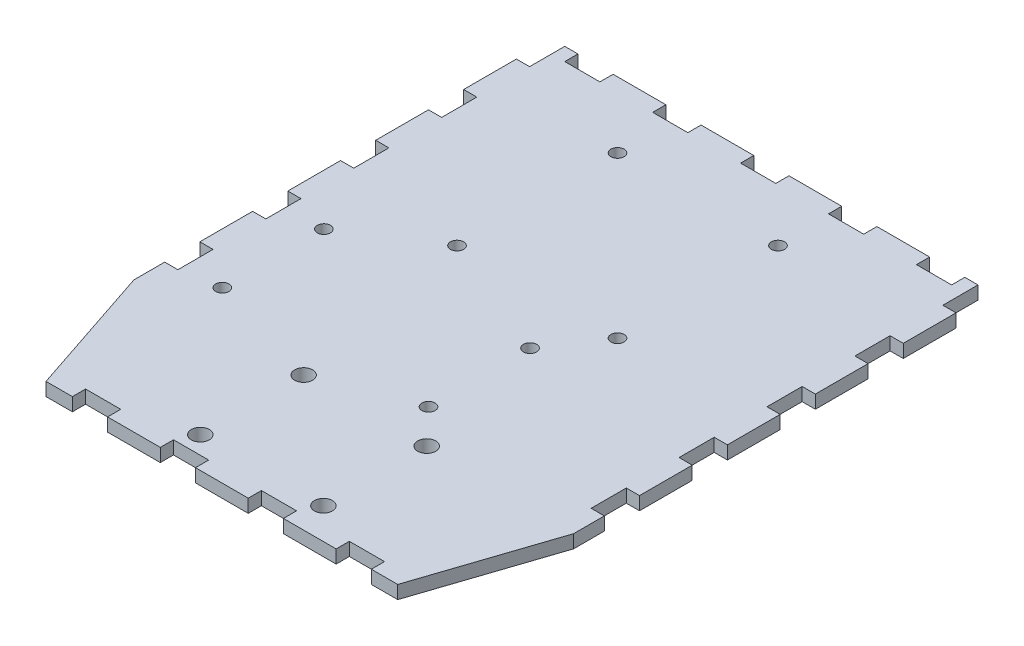
from build123d import *

# Parameters (mm, degrees)
ESQUISSE1_R        = 2.05
ESQUISSE1_R_2      = 1.5
BOSS_EXTRU_1_DEPTH = 3


with BuildPart() as part:
    # Esquisse1 → Boss.-Extru.1 (new body)
    with BuildSketch(Plane(origin=(0, 0, 0), x_dir=(1, 0, 0), z_dir=(0, 1, 0))):
        Polygon((44, -30), (56, -30), (56, -27), (64, -27), (64, -30), (76, -30), (76, -27), (84, -27), (84, -30), (90, -30), (100, 0), (100, 7), (97, 7), (97, 15), (100, 15), (100, 27), (97, 27), (97, 35), (100, 35), (100, 47), (97, 47), (97, 55), (100, 55), (100, 67), (97, 67), (97, 75), (100, 75), (100, 87), (97, 87), (97, 95), (94, 95), (94, 92), (86, 92), (86, 95), (74, 95), (74, 92), (66, 92), (66, 95), (54, 95), (54, 92), (46, 92), (46, 95), (34, 95), (34, 92), (26, 92), (26, 95), (14, 95), (14, 92), (6, 92), (6, 95), (3, 95), (3, 87), (0, 87), (0, 75), (3, 75), (3, 67), (0, 67), (0, 55), (3, 55), (3, 47), (0, 47), (0, 35), (3, 35), (3, 27), (0, 27), (0, 15), (3, 15), (3, 7), (0, 7), (0, 0), (10, -30), (16, -30), (16, -27), (24, -27), (24, -30), (36, -30), (36, -27), (44, -27), align=None)
        with Locations((38.05, 0.55)):
            Circle(ESQUISSE1_R, mode=Mode.SUBTRACT)
        with Locations((38.05, -22.95)):
            Circle(ESQUISSE1_R, mode=Mode.SUBTRACT)
        with Locations((30, 43.5)):
            Circle(ESQUISSE1_R_2, mode=Mode.SUBTRACT)
        with Locations((30, 80)):
            Circle(ESQUISSE1_R_2, mode=Mode.SUBTRACT)
        with Locations((11.604719745, 8.5)):
            Circle(ESQUISSE1_R_2, mode=Mode.SUBTRACT)
        with Locations((11.604719745, 31.6)):
            Circle(ESQUISSE1_R_2, mode=Mode.SUBTRACT)
        with Locations((66.05, -22.95)):
            Circle(ESQUISSE1_R, mode=Mode.SUBTRACT)
        with Locations((66.05, 0.55)):
            Circle(ESQUISSE1_R, mode=Mode.SUBTRACT)
        with Locations((66.5, 80)):
            Circle(ESQUISSE1_R_2, mode=Mode.SUBTRACT)
        with Locations((58.504719745, 31.6)):
            Circle(ESQUISSE1_R_2, mode=Mode.SUBTRACT)
        with Locations((66.5, 43.5)):
            Circle(ESQUISSE1_R_2, mode=Mode.SUBTRACT)
        with Locations((58.504719745, 8.5)):
            Circle(ESQUISSE1_R_2, mode=Mode.SUBTRACT)
    extrude(amount=BOSS_EXTRU_1_DEPTH)


solid = part.part
